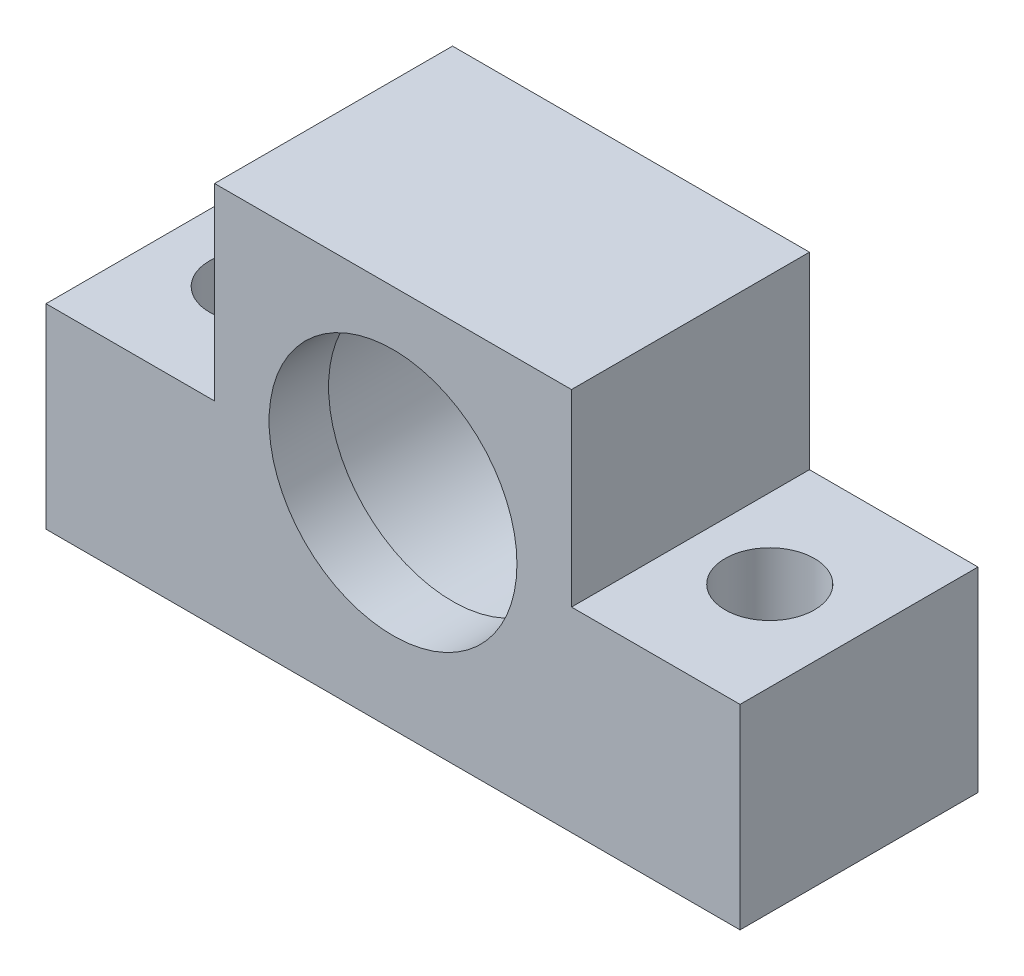
from build123d import *

# Parameters (mm, degrees)
ESBO_O1_R                     = 14
RESSALTO_EXTRUS_O3_DEPTH      = 18
ESBO_O3_R                     = 14
ESBO_O3_R_2                   = 12.5
RESSALTO_EXTRUS_O4_DEPTH      = 6
ESBO_O4_R                     = 4.5
CORTE_EXTRUS_O1_DEPTH         = 47.787712062
FURO_ROSCADO_DE_M3X0_51_D     = 2.5
FURO_ROSCADO_DE_M3X0_51_DEPTH = 7.5
FURO_ROSCADO_DE_M3X0_51_TIP   = 0.751075774


with BuildPart() as part:
    # Esboço1 → Ressalto-extrusão3 (new body)
    with BuildSketch(Plane.XY):
        Polygon((-35, 0), (35, 0), (35, 19.7), (18, 19.7), (18, 38.7), (-18, 38.7), (-18, 19.7), (-35, 19.7), align=None)
        with Locations((0, 20.7)):
            Circle(ESBO_O1_R, mode=Mode.SUBTRACT)
    extrude(amount=RESSALTO_EXTRUS_O3_DEPTH)

    # Esboço3 → Ressalto-extrusão4 (add)
    # profile 1 of 2: a face of its own
    with BuildSketch(Plane.XY.offset(18)):
        Polygon((35, 0), (35, 19.7), (18, 19.7), (18, 38.7), (-18, 38.7), (-18, 19.7), (-35, 19.7), (-35, 0), align=None)
        with Locations((0, 20.7)):
            Circle(ESBO_O3_R, mode=Mode.SUBTRACT)
    # profile 2 of 2: a face of its own
    with BuildSketch(Plane.XY.offset(18)):
        with Locations((0, 20.7)):
            Circle(ESBO_O3_R)
        with Locations((0, 20.7)):
            Circle(ESBO_O3_R_2, mode=Mode.SUBTRACT)
    extrude(amount=RESSALTO_EXTRUS_O4_DEPTH)

    # Esboço4 → Corte-extrusão1 (cut, through all)
    with BuildSketch(Plane(origin=(0, 19.7, 0), x_dir=(1, 0, 0), z_dir=(0, 1, 0))):
        with Locations(Location((-26, -12, 0), (0, 0, 180))):
            Circle(ESBO_O4_R)
        with Locations((26, -12)):
            Circle(ESBO_O4_R)
    extrude(amount=-CORTE_EXTRUS_O1_DEPTH, mode=Mode.SUBTRACT)

    # Furo roscado de M3x0.51
    with Locations(Plane(origin=(0, 0, 0), x_dir=(-1, 0, 0), z_dir=(0, 0, -1))):
        with Locations((14.142135624, 34.842135624), (14.142135624, 6.557864376), (-14.142135624, 6.557864376), (-14.142135624, 34.842135624)):
            Hole(FURO_ROSCADO_DE_M3X0_51_D / 2, depth=FURO_ROSCADO_DE_M3X0_51_DEPTH)
            with Locations((0, 0, -(FURO_ROSCADO_DE_M3X0_51_DEPTH + FURO_ROSCADO_DE_M3X0_51_TIP / 2))):  # 118° drill point
                Cone(0, FURO_ROSCADO_DE_M3X0_51_D / 2, FURO_ROSCADO_DE_M3X0_51_TIP, mode=Mode.SUBTRACT)


solid = part.part
